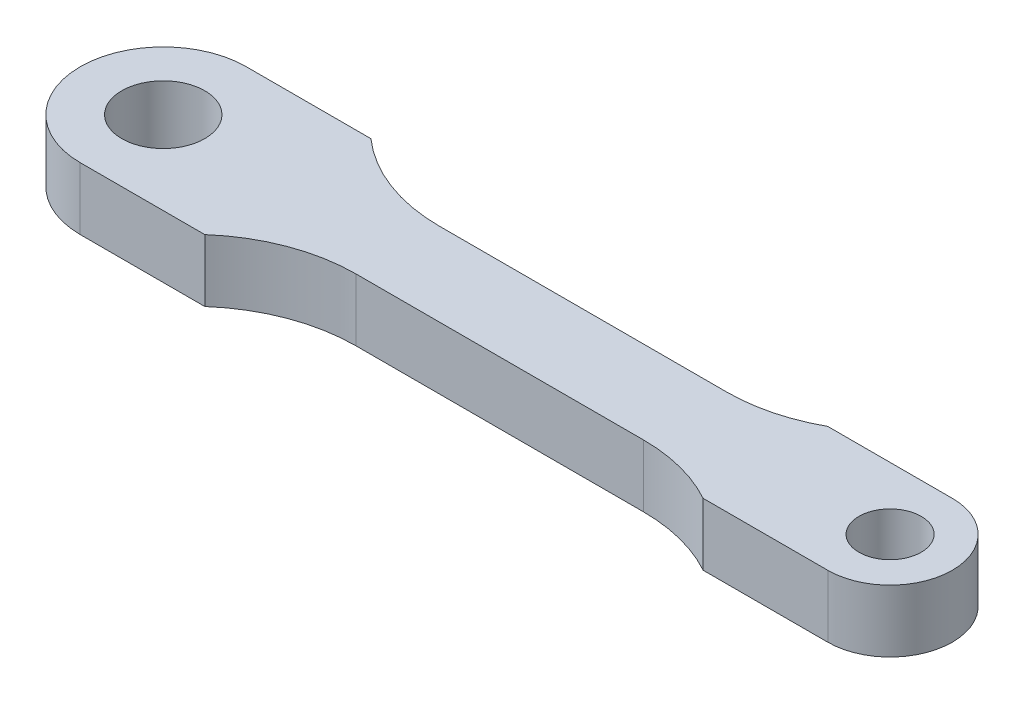
from build123d import *

# Parameters (mm, degrees)
SKETCH1_R           = 2
SKETCH1_R_2         = 1.5
BOSS_EXTRUDE1_DEPTH = 3


with BuildPart() as part:
    # Sketch1 → Boss-Extrude1 (new body)
    with BuildSketch(Plane(origin=(0, 0, 0), x_dir=(1, 0, 0), z_dir=(0, 1, 0))):
        with BuildLine():
            Line((0, 4), (6, 4))
            ThreePointArc((6, 4), (8.463075497, 2.516685226), (11.291502622, 2))
            Line((11.291502622, 2), (25.127016654, 2))
            ThreePointArc((25.127016654, 2), (27.127016654, 2.254033308), (29, 3))
            Line((29, 3), (35, 3))
            ThreePointArc((35, 3), (38, 0), (35, -3))
            Line((35, -3), (29, -3))
            ThreePointArc((29, -3), (27.127016654, -2.254033308), (25.127016654, -2))
            Line((25.127016654, -2), (11.291502622, -2))
            ThreePointArc((11.291502622, -2), (8.463075497, -2.516685226), (6, -4))
            Line((6, -4), (0, -4))
            ThreePointArc((0, -4), (-4, 0), (0, 4))
        make_face()
        with Locations(Location((0, 0, 0), (0, 0, 270))):
            Circle(SKETCH1_R, mode=Mode.SUBTRACT)
        with Locations(Location((35, 0, 0), (0, 0, 270))):
            Circle(SKETCH1_R_2, mode=Mode.SUBTRACT)
    extrude(amount=BOSS_EXTRUDE1_DEPTH)


solid = part.part
